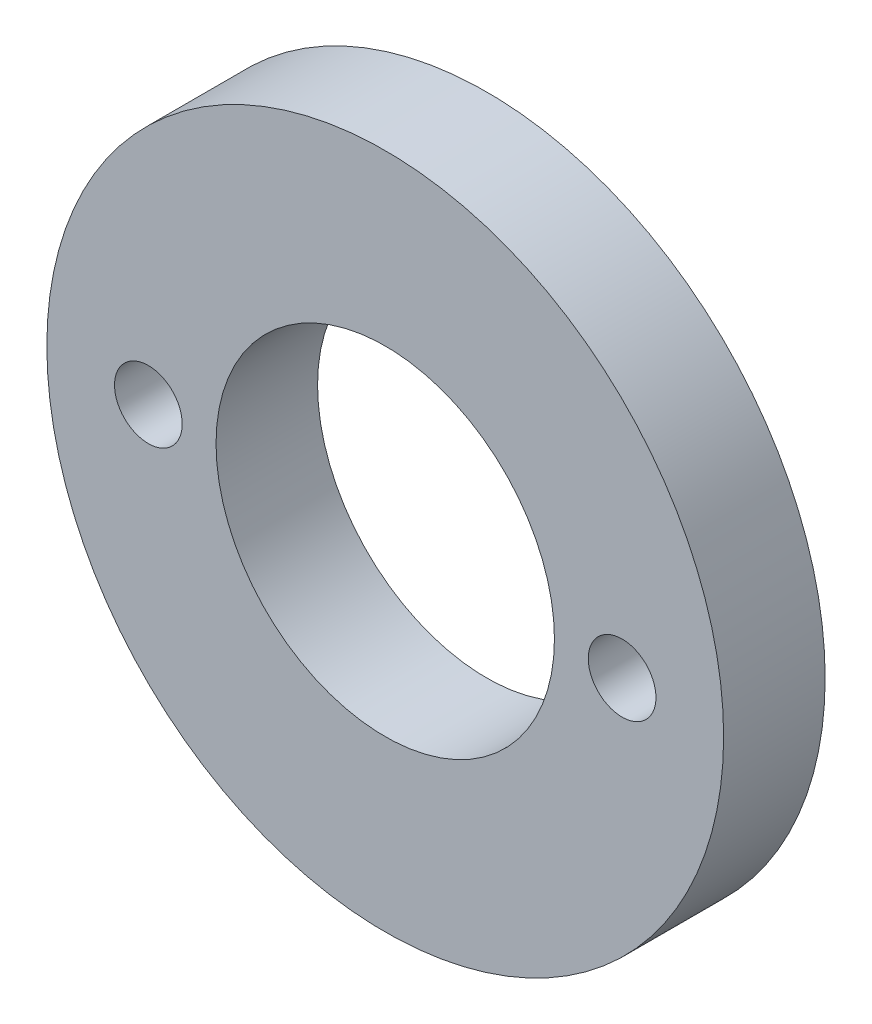
from build123d import *

# Parameters (mm, degrees)
SKETCH1_R               = 10
SKETCH1_R_2             = 5
BOSS_EXTRUDE1_DEPTH     = 1.5
SKETCH3_R               = 1
ALIGNMENTHOLE_CUT_DEPTH = 15.456832295
CIRPATTERN1_COUNT       = 2


with BuildPart() as part:
    # Sketch1 → Boss-Extrude1 (new, symmetric)
    with BuildSketch(Plane.XY):
        Circle(SKETCH1_R)
        Circle(SKETCH1_R_2, mode=Mode.SUBTRACT)
    extrude(amount=BOSS_EXTRUDE1_DEPTH, both=True)

    # Sketch3 → AlignmentHole-Cut (cut, through all)
    with BuildSketch(Plane.XY.offset(1.5)):
        with Locations((-7, 0)):
            Circle(SKETCH3_R)
    alignmenthole_cut = extrude(amount=-ALIGNMENTHOLE_CUT_DEPTH, mode=Mode.SUBTRACT)

    # CirPattern1: AlignmentHole-Cut ×2 about axis
    cirpattern1_axis = Axis((0, 0, 0), (0, 0, 1))
    for i in range(1, CIRPATTERN1_COUNT):
        add(alignmenthole_cut.rotate(cirpattern1_axis, i * 360 / CIRPATTERN1_COUNT), mode=Mode.SUBTRACT)


solid = part.part
